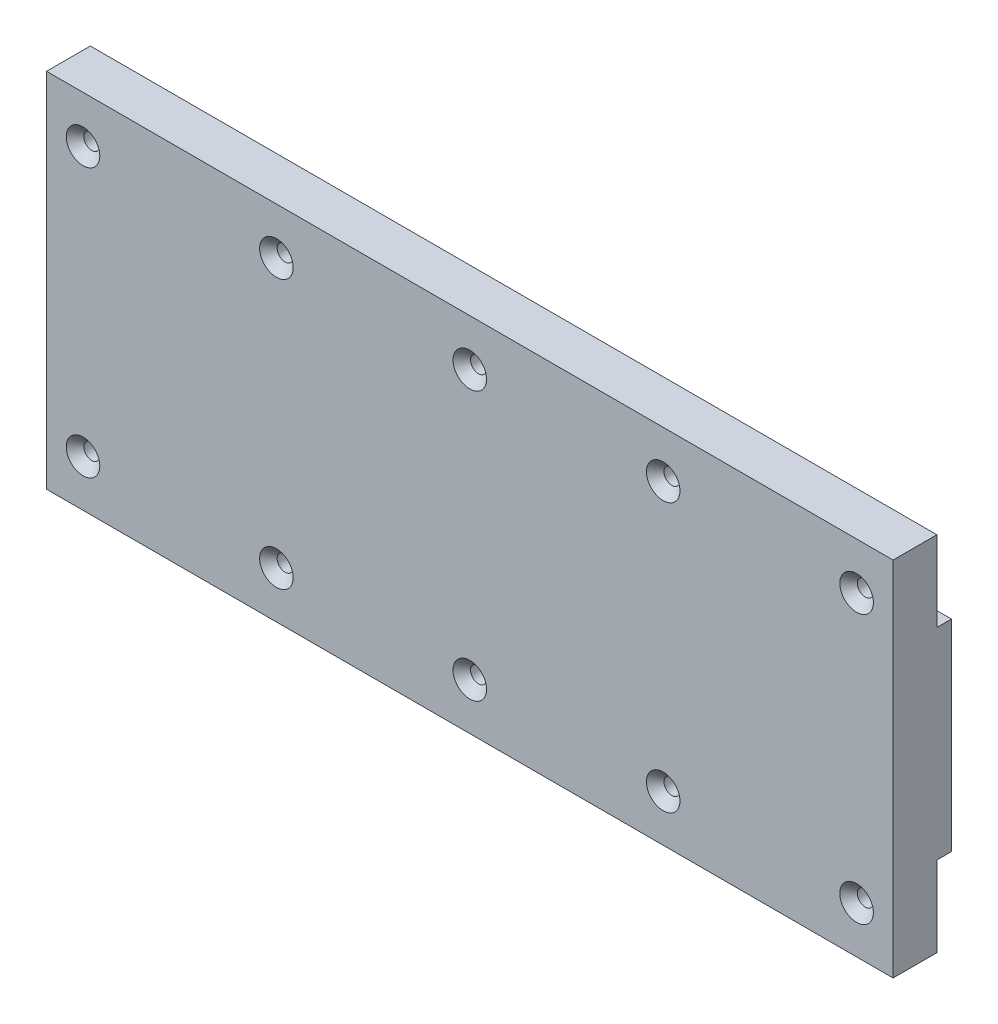
from build123d import *

# Parameters (mm, degrees)
SALIENTE_EXTRUIR1_DEPTH = 580
CORTAR_EXTRUIR1_REACH   = 634.063
CROQUIS2_R              = 5.5
CHAFL_N1_SIZE           = 6


with BuildPart() as part:
    # Croquis1 → Saliente-Extruir1 (new body)
    with BuildSketch(Plane(origin=(0, 0, 0), x_dir=(0, 0, -1), z_dir=(1, 0, 0))):
        Polygon((0, 0), (30, 0), (30, 55), (40, 55), (40, 193), (30, 193), (30, 248), (0, 248), align=None)
    extrude(amount=SALIENTE_EXTRUIR1_DEPTH)

    # Croquis2 → Cortar-Extruir1 (cut, up to next)
    with BuildSketch(Plane.XY, mode=Mode.PRIVATE) as cortar_extruir1_sk1:
        with Locations((25, 216)):
            Circle(CROQUIS2_R)
    cortar_extruir1_tool1 = extrude(cortar_extruir1_sk1.sketch, amount=-CORTAR_EXTRUIR1_REACH, mode=Mode.PRIVATE) & part.part
    # Croquis2 → Cortar-Extruir1 (cut, up to next)
    with BuildSketch(Plane.XY, mode=Mode.PRIVATE) as cortar_extruir1_sk2:
        with Locations((25, 32)):
            Circle(CROQUIS2_R)
    cortar_extruir1_tool2 = extrude(cortar_extruir1_sk2.sketch, amount=-CORTAR_EXTRUIR1_REACH, mode=Mode.PRIVATE) & part.part
    # Croquis2 → Cortar-Extruir1 (cut, up to next)
    with BuildSketch(Plane.XY, mode=Mode.PRIVATE) as cortar_extruir1_sk3:
        with Locations((157.5, 216)):
            Circle(CROQUIS2_R)
    cortar_extruir1_tool3 = extrude(cortar_extruir1_sk3.sketch, amount=-CORTAR_EXTRUIR1_REACH, mode=Mode.PRIVATE) & part.part
    # Croquis2 → Cortar-Extruir1 (cut, up to next)
    with BuildSketch(Plane.XY, mode=Mode.PRIVATE) as cortar_extruir1_sk4:
        with Locations((157.5, 32)):
            Circle(CROQUIS2_R)
    cortar_extruir1_tool4 = extrude(cortar_extruir1_sk4.sketch, amount=-CORTAR_EXTRUIR1_REACH, mode=Mode.PRIVATE) & part.part
    # Croquis2 → Cortar-Extruir1 (cut, up to next)
    with BuildSketch(Plane.XY, mode=Mode.PRIVATE) as cortar_extruir1_sk5:
        with Locations((290, 216)):
            Circle(CROQUIS2_R)
    cortar_extruir1_tool5 = extrude(cortar_extruir1_sk5.sketch, amount=-CORTAR_EXTRUIR1_REACH, mode=Mode.PRIVATE) & part.part
    # Croquis2 → Cortar-Extruir1 (cut, up to next)
    with BuildSketch(Plane.XY, mode=Mode.PRIVATE) as cortar_extruir1_sk6:
        with Locations((290, 32)):
            Circle(CROQUIS2_R)
    cortar_extruir1_tool6 = extrude(cortar_extruir1_sk6.sketch, amount=-CORTAR_EXTRUIR1_REACH, mode=Mode.PRIVATE) & part.part
    # Croquis2 → Cortar-Extruir1 (cut, up to next)
    with BuildSketch(Plane.XY, mode=Mode.PRIVATE) as cortar_extruir1_sk7:
        with Locations((422.5, 216)):
            Circle(CROQUIS2_R)
    cortar_extruir1_tool7 = extrude(cortar_extruir1_sk7.sketch, amount=-CORTAR_EXTRUIR1_REACH, mode=Mode.PRIVATE) & part.part
    # Croquis2 → Cortar-Extruir1 (cut, up to next)
    with BuildSketch(Plane.XY, mode=Mode.PRIVATE) as cortar_extruir1_sk8:
        with Locations((422.5, 32)):
            Circle(CROQUIS2_R)
    cortar_extruir1_tool8 = extrude(cortar_extruir1_sk8.sketch, amount=-CORTAR_EXTRUIR1_REACH, mode=Mode.PRIVATE) & part.part
    # Croquis2 → Cortar-Extruir1 (cut, up to next)
    with BuildSketch(Plane.XY, mode=Mode.PRIVATE) as cortar_extruir1_sk9:
        with Locations((555, 216)):
            Circle(CROQUIS2_R)
    cortar_extruir1_tool9 = extrude(cortar_extruir1_sk9.sketch, amount=-CORTAR_EXTRUIR1_REACH, mode=Mode.PRIVATE) & part.part
    # Croquis2 → Cortar-Extruir1 (cut, up to next)
    with BuildSketch(Plane.XY, mode=Mode.PRIVATE) as cortar_extruir1_sk10:
        with Locations((555, 32)):
            Circle(CROQUIS2_R)
    cortar_extruir1_tool10 = extrude(cortar_extruir1_sk10.sketch, amount=-CORTAR_EXTRUIR1_REACH, mode=Mode.PRIVATE) & part.part
    add(cortar_extruir1_tool1.solids().sort_by_distance((25, 216, 0))[0], mode=Mode.SUBTRACT)
    add(cortar_extruir1_tool2.solids().sort_by_distance((25, 32, 0))[0], mode=Mode.SUBTRACT)
    add(cortar_extruir1_tool3.solids().sort_by_distance((157.5, 216, 0))[0], mode=Mode.SUBTRACT)
    add(cortar_extruir1_tool4.solids().sort_by_distance((157.5, 32, 0))[0], mode=Mode.SUBTRACT)
    add(cortar_extruir1_tool5.solids().sort_by_distance((290, 216, 0))[0], mode=Mode.SUBTRACT)
    add(cortar_extruir1_tool6.solids().sort_by_distance((290, 32, 0))[0], mode=Mode.SUBTRACT)
    add(cortar_extruir1_tool7.solids().sort_by_distance((422.5, 216, 0))[0], mode=Mode.SUBTRACT)
    add(cortar_extruir1_tool8.solids().sort_by_distance((422.5, 32, 0))[0], mode=Mode.SUBTRACT)
    add(cortar_extruir1_tool9.solids().sort_by_distance((555, 216, 0))[0], mode=Mode.SUBTRACT)
    add(cortar_extruir1_tool10.solids().sort_by_distance((555, 32, 0))[0], mode=Mode.SUBTRACT)

    # Chaflán1
    chafl_n1_edges = [part.edges().sort_by_distance(p)[0] for p in [
        (19.5, 216, 0),
        (284.5, 32, 0),
        (417, 216, 0),
        (417, 32, 0),
        (549.5, 216, 0),
        (549.5, 32, 0),
        (19.5, 32, 0),
        (152, 216, 0),
        (152, 32, 0),
        (284.5, 216, 0),
    ]]
    chamfer(chafl_n1_edges, length=CHAFL_N1_SIZE)


solid = part.part
